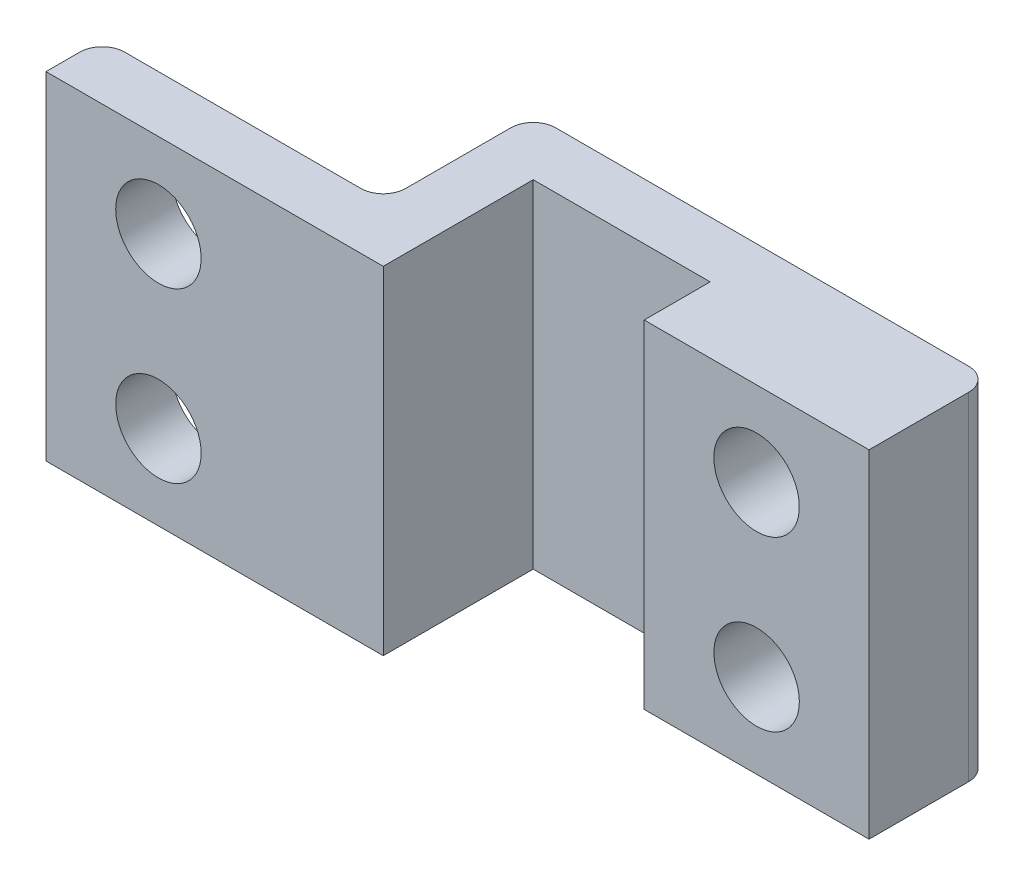
from build123d import *

# Parameters (mm, degrees)
SKETCH1_W           = 38.1
SKETCH1_H           = 38.1
BOSS_EXTRUDE1_DEPTH = 6.35
SKETCH2_W           = 6.35
SKETCH2_H           = 38.1
BOSS_EXTRUDE2_DEPTH = 16.9418
SKETCH4_W           = 6.35
SKETCH4_H           = 38.1
BOSS_EXTRUDE3_DEPTH = 45.3898
SKETCH5_W           = 25.4
SKETCH5_H           = 38.1
BOSS_EXTRUDE4_DEPTH = 7.4549
SKETCH6_R           = 4.826
CUT_EXTRUDE1_DEPTH  = 70.299458232
SKETCH8_R           = 4.826
CUT_EXTRUDE2_DEPTH  = 69.600040729
FILLET7_R           = 2.54


with BuildPart() as part:
    # Sketch1 → Boss-Extrude1 (new body)
    with BuildSketch(Plane.XY):
        Rectangle(SKETCH1_W, SKETCH1_H)
    extrude(amount=-BOSS_EXTRUDE1_DEPTH)

    # Sketch2 → Boss-Extrude2 (add)
    with BuildSketch(Plane(origin=(0, 0, -6.35), x_dir=(-1, 0, 0), z_dir=(0, 0, -1))):
        with Locations((-15.875, 0)):
            Rectangle(SKETCH2_W, SKETCH2_H)
    extrude(amount=BOSS_EXTRUDE2_DEPTH)

    # Sketch4 → Boss-Extrude3 (add)
    with BuildSketch(Plane(origin=(19.05, 0, 0), x_dir=(0, 0, -1), z_dir=(1, 0, 0))):
        with Locations((20.1168, 0)):
            Rectangle(SKETCH4_W, SKETCH4_H)
    extrude(amount=BOSS_EXTRUDE3_DEPTH)

    # Sketch5 → Boss-Extrude4 (add)
    with BuildSketch(Plane.XY.offset(-16.9418)):
        with Locations((51.7398, 0)):
            Rectangle(SKETCH5_W, SKETCH5_H)
    extrude(amount=BOSS_EXTRUDE4_DEPTH)

    # Sketch6 → Cut-Extrude1 (cut, through all)
    with BuildSketch(Plane(origin=(0, 0, -6.35), x_dir=(-1, 0, 0), z_dir=(0, 0, -1))):
        with Locations((6.35, 9.525)):
            Circle(SKETCH6_R)
        with Locations(Location((6.35, -9.525, 0), (0, 0, 180))):
            Circle(SKETCH6_R)
    extrude(amount=-CUT_EXTRUDE1_DEPTH, mode=Mode.SUBTRACT)

    # Sketch8 → Cut-Extrude2 (cut, through all)
    with BuildSketch(Plane.XY.offset(-9.4869)):
        with Locations((51.7398, -9.525)):
            Circle(SKETCH8_R)
        with Locations(Location((51.7398, 9.525, 0), (0, 0, 180))):
            Circle(SKETCH8_R)
    extrude(amount=-CUT_EXTRUDE2_DEPTH, mode=Mode.SUBTRACT)

    # Fillet7
    fillet7_edges = [part.edges().sort_by_distance(p)[0] for p in [
        (-19.05, 0, -6.35),
        (12.7, 0, -6.35),
        (12.7, 0, -23.2918),
        (64.4398, 0, -23.2918),
    ]]
    fillet(fillet7_edges, radius=FILLET7_R)


solid = part.part
